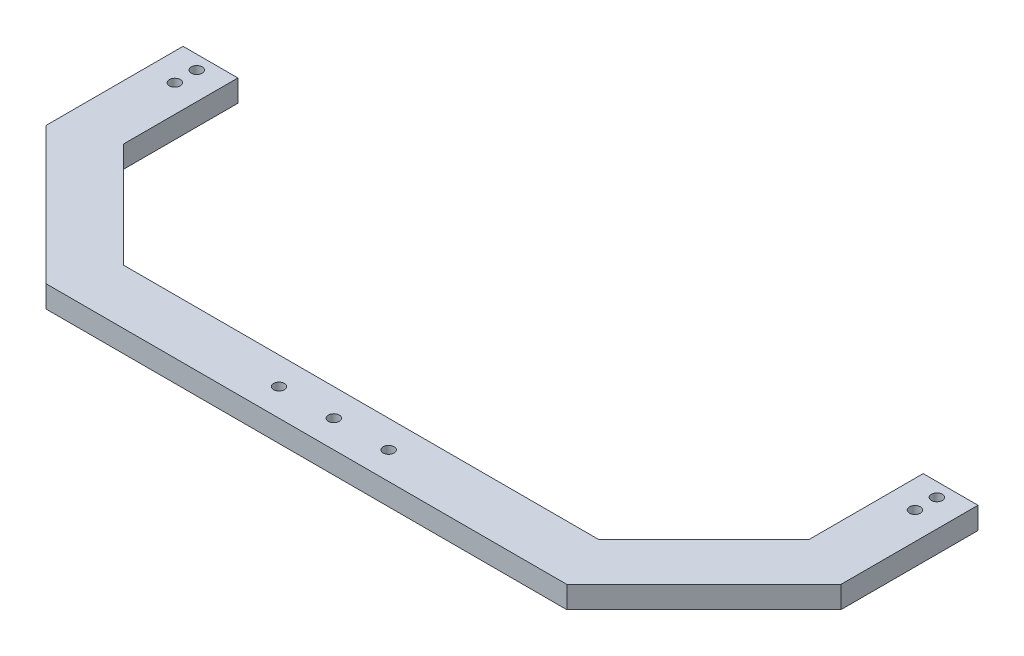
from build123d import *

# Parameters (mm, degrees)
SKETCH1_R           = 1
BOSS_EXTRUDE1_DEPTH = 4
SKETCH2_R           = 1
CUT_EXTRUDE1_DEPTH  = 4


with BuildPart() as part:
    # Sketch1 → Boss-Extrude1 (new body)
    with BuildSketch(Plane(origin=(0, 0, 0), x_dir=(1, 0, 0), z_dir=(0, 1, 0))):
        Polygon((0, 0), (47.5, 0), (72.5, 25), (72.5, 50), (62.5, 50), (62.5, 29.142135624), (43.357864376, 10), (0, 10), (-43.357864376, 10), (-62.5, 29.142135624), (-62.5, 50), (-72.5, 50), (-72.5, 25), (-47.5, 0), align=None)
        with Locations(Location((10, 5, 0), (0, 0, 270))):
            Circle(SKETCH1_R, mode=Mode.SUBTRACT)
        with Locations(Location((0, 5, 0), (0, 0, 270))):
            Circle(SKETCH1_R, mode=Mode.SUBTRACT)
        with Locations(Location((-10, 5, 0), (0, 0, 90))):
            Circle(SKETCH1_R, mode=Mode.SUBTRACT)
    extrude(amount=BOSS_EXTRUDE1_DEPTH)

    # Sketch2 → Cut-Extrude1 (cut)
    with BuildSketch(Plane(origin=(0, 4, 0), x_dir=(1, 0, 0), z_dir=(0, 1, 0))):
        with Locations(Location((67.5, 47.5, 0), (0, 0, 270))):
            Circle(SKETCH2_R)
        with Locations(Location((67.5, 43.5, 0), (0, 0, 270))):
            Circle(SKETCH2_R)
        with Locations(Location((-67.5, 43.5, 0), (0, 0, 90))):
            Circle(SKETCH2_R)
        with Locations(Location((-67.5, 47.5, 0), (0, 0, 90))):
            Circle(SKETCH2_R)
    extrude(amount=-CUT_EXTRUDE1_DEPTH, mode=Mode.SUBTRACT)


solid = part.part
